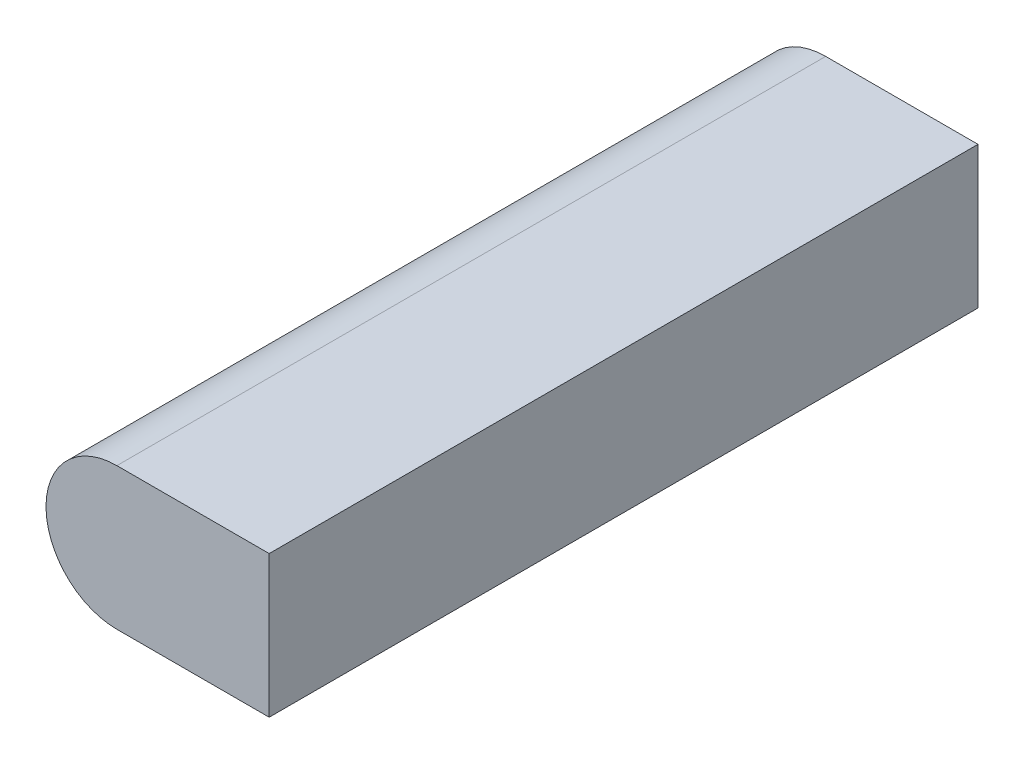
from build123d import *

# Parameters (mm, degrees)
BOSS_EXTRUDE1_DEPTH = 10


with BuildPart() as part:
    # Sketch1 → Boss-Extrude1 (new body)
    with BuildSketch(Plane.XY):
        with BuildLine():
            Line((0, 1), (2.148843362, 1))
            Line((2.148843362, 1), (2.148843362, -1))
            Line((2.148843362, -1), (0, -1))
            ThreePointArc((0, -1), (-1, 0), (0, 1))
        make_face()
    extrude(amount=BOSS_EXTRUDE1_DEPTH)


solid = part.part
